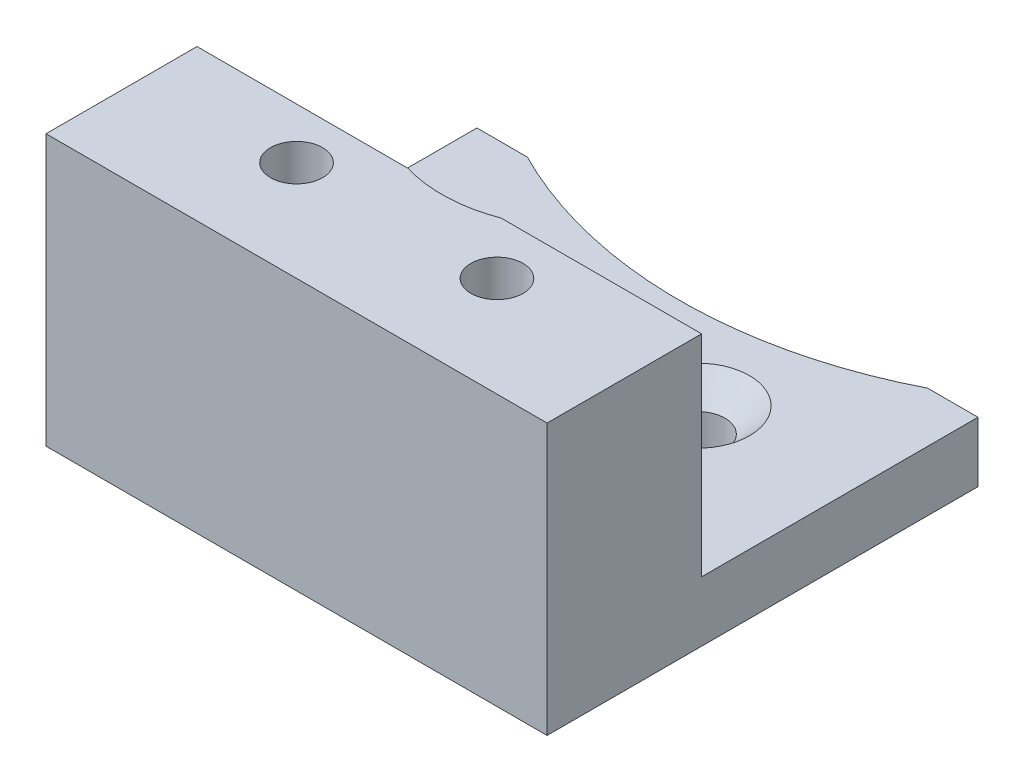
from build123d import *

# Parameters (mm, degrees)
SKETCH1_R                                       = 2.6
BOSS_EXTRUDE1_DEPTH                             = 6
SKETCH2_R                                       = 3.25
BOSS_EXTRUDE2_DEPTH                             = 2
SKETCH3_R                                       = 2.5
BOSS_EXTRUDE3_DEPTH                             = 2.7
CSK_FOR_M5_FLAT_HEAD_MACHINE_SCREW1_D           = 5.5
CSK_FOR_M5_FLAT_HEAD_MACHINE_SCREW1_CSINK_D     = 10.4
CSK_FOR_M5_FLAT_HEAD_MACHINE_SCREW1_CSINK_ANGLE = 90
SKETCH7_R                                       = 2.6
BOSS_EXTRUDE5_DEPTH                             = 21


with BuildPart() as part:
    # Sketch1 → Boss-Extrude1 (new body)
    with BuildSketch(Plane(origin=(0, 0, 0), x_dir=(1, 0, 0), z_dir=(0, 1, 0))):
        with BuildLine():
            Line((5.031184409, -3), (0, -3))
            Line((0, -3), (0, -46))
            Line((0, -46), (50, -46))
            Line((50, -46), (50, -3))
            Line((50, -3), (44.968815591, -3))
            ThreePointArc((44.968815591, -3), (25, -7.79226602), (5.031184409, -3))
        make_face()
        with Locations(Location((15, -36, 0), (0, 0, 270))):
            Circle(SKETCH1_R, mode=Mode.SUBTRACT)
        with Locations(Location((35, -36, 0), (0, 0, 270))):
            Circle(SKETCH1_R, mode=Mode.SUBTRACT)
        with Locations(Location((15, -16, 0), (0, 0, 270))):
            Circle(SKETCH1_R, mode=Mode.SUBTRACT)
        with Locations(Location((35, -16, 0), (0, 0, 270))):
            Circle(SKETCH1_R, mode=Mode.SUBTRACT)
    extrude(amount=BOSS_EXTRUDE1_DEPTH)

    # Sketch2 → Boss-Extrude2 (add)
    with BuildSketch(Plane(origin=(0, 6, 0), x_dir=(1, 0, 0), z_dir=(0, 1, 0))):
        with Locations(Location((25, -17.5, 0), (0, 0, 270))):
            Circle(SKETCH2_R)
    extrude(amount=BOSS_EXTRUDE2_DEPTH)

    # Sketch3 → Boss-Extrude3 (add)
    with BuildSketch(Plane(origin=(0, 8, 0), x_dir=(1, 0, 0), z_dir=(0, 1, 0))):
        with Locations(Location((25, -17.5, 0), (0, 0, 90))):
            Circle(SKETCH3_R)
    extrude(amount=BOSS_EXTRUDE3_DEPTH)

    # CSK for M5 Flat Head Machine Screw1 (through all)
    with Locations(Plane(origin=(0, 6, 0), x_dir=(1, 0, 0), z_dir=(0, 1, 0))):
        with Locations((15, -16), (35, -16)):
            CounterSinkHole(CSK_FOR_M5_FLAT_HEAD_MACHINE_SCREW1_D / 2, CSK_FOR_M5_FLAT_HEAD_MACHINE_SCREW1_CSINK_D / 2, counter_sink_angle=CSK_FOR_M5_FLAT_HEAD_MACHINE_SCREW1_CSINK_ANGLE)

    # Sketch7 → Boss-Extrude5 (add)
    with BuildSketch(Plane(origin=(0, 6, 0), x_dir=(1, 0, 0), z_dir=(0, 1, 0))):
        with BuildLine():
            Line((21.039948447, -30.928253487), (0, -30.928253487))
            Line((0, -30.928253487), (0, -46))
            Line((0, -46), (50, -46))
            Line((50, -46), (50, -30.580877922))
            Line((50, -30.580877922), (29.989051292, -30.580877922))
            ThreePointArc((29.989051292, -30.580877922), (25.543026299, -31.489464694), (21.039948447, -30.928253487))
        make_face()
        with Locations(Location((15, -36, 0), (0, 0, 270))):
            Circle(SKETCH7_R, mode=Mode.SUBTRACT)
        with Locations(Location((35, -36, 0), (0, 0, 270))):
            Circle(SKETCH7_R, mode=Mode.SUBTRACT)
    extrude(amount=BOSS_EXTRUDE5_DEPTH)


solid = part.part
